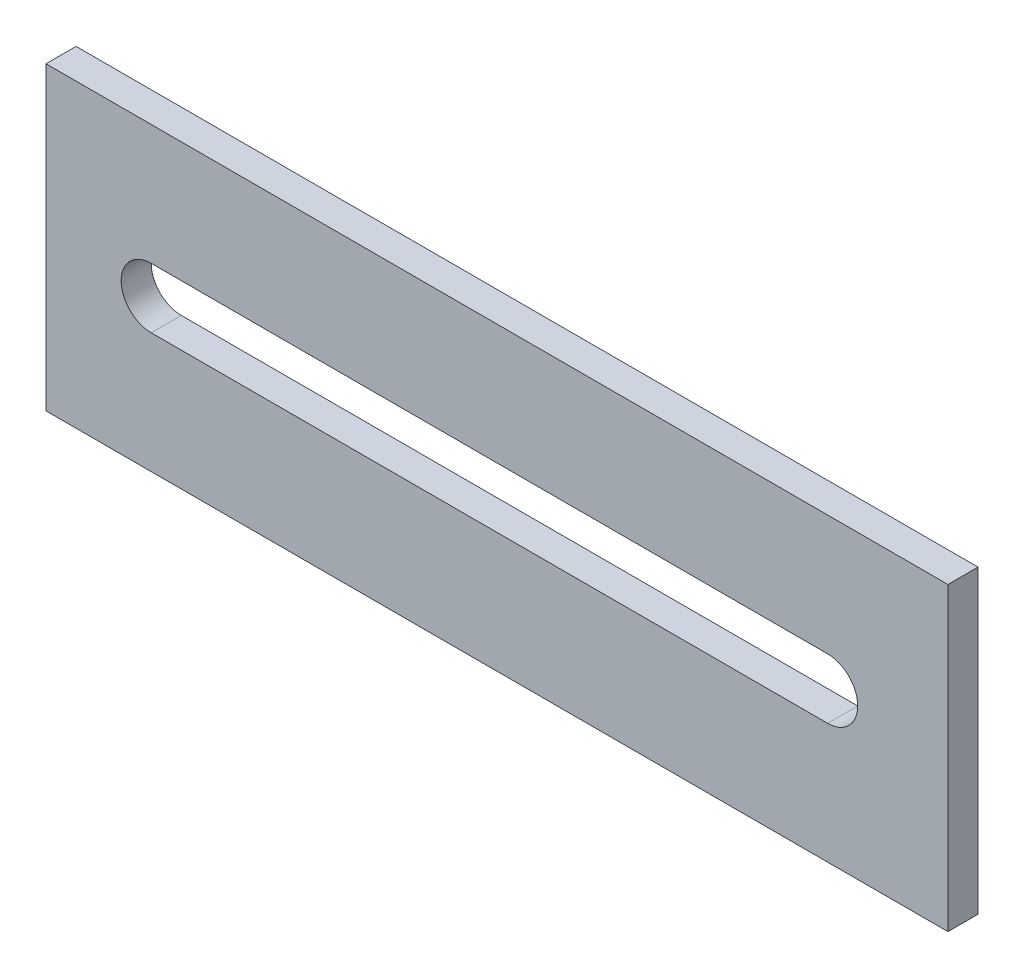
from build123d import *

# Parameters (mm, degrees)
SKETCH1_W           = 60
SKETCH1_H           = 20
BOSS_EXTRUDE1_DEPTH = 2
CUT_EXTRUDE1_DEPTH  = 2


with BuildPart() as part:
    # Sketch1 → Boss-Extrude1 (new body)
    with BuildSketch(Plane.XY):
        Rectangle(SKETCH1_W, SKETCH1_H)
    extrude(amount=BOSS_EXTRUDE1_DEPTH)

    # Sketch2 → Cut-Extrude1 (cut)
    with BuildSketch(Plane.XY.offset(2)):
        with BuildLine():
            Line((-23, 2), (22, 2))
            ThreePointArc((22, 2), (24, 0), (22, -2))
            Line((22, -2), (-23, -2))
            ThreePointArc((-23, -2), (-25, 0), (-23, 2))
        make_face()
    extrude(amount=-CUT_EXTRUDE1_DEPTH, mode=Mode.SUBTRACT)


solid = part.part
